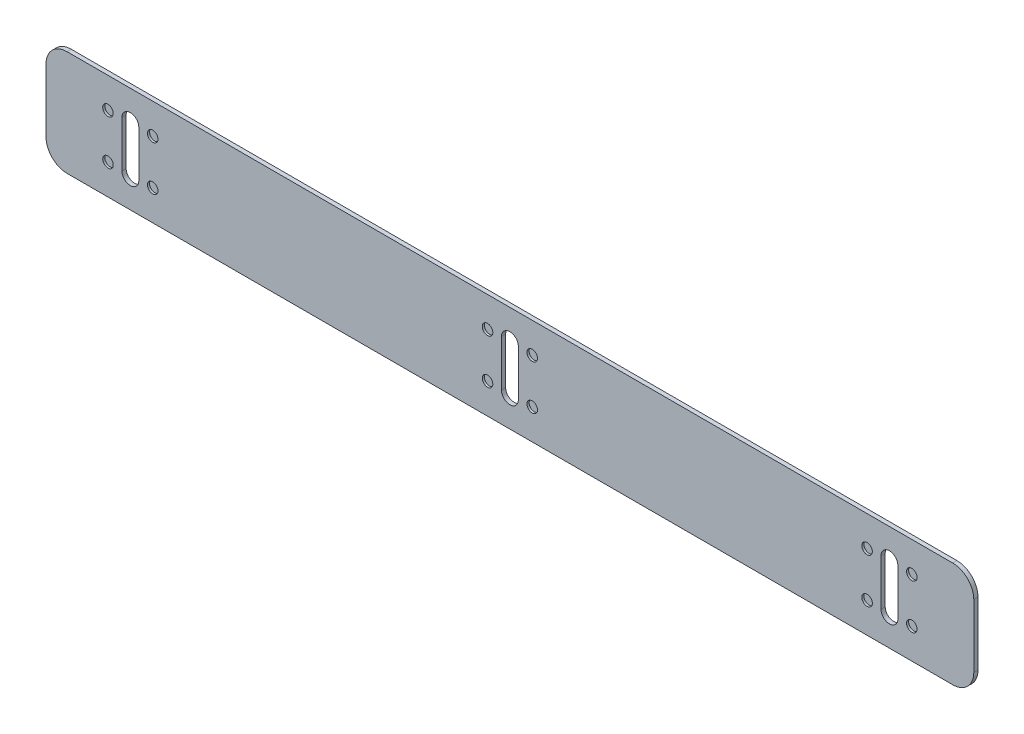
from build123d import *

# Parameters (mm, degrees)
BOSS_EXTRUDE1_DEPTH = 0.2
SKETCH2_R           = 0.25
CUT_EXTRUDE1_DEPTH  = 0.1


with BuildPart() as part:
    # Sketch1 → Boss-Extrude1 (new body)
    with BuildSketch(Plane.XY):
        with BuildLine():
            Line((-13.983305509, 11.944444444), (28.016694491, 11.944444444))
            ThreePointArc((28.016694491, 11.944444444), (28.723801272, 11.651551226), (29.016694491, 10.944444444))
            Line((29.016694491, 10.944444444), (29.016694491, 7.944444444))
            ThreePointArc((29.016694491, 7.944444444), (28.723801272, 7.237337663), (28.016694491, 6.944444444))
            Line((28.016694491, 6.944444444), (-13.983305509, 6.944444444))
            ThreePointArc((-13.983305509, 6.944444444), (-14.69041229, 7.237337663), (-14.983305509, 7.944444444))
            Line((-14.983305509, 7.944444444), (-14.983305509, 10.944444444))
            ThreePointArc((-14.983305509, 10.944444444), (-14.69041229, 11.651551226), (-13.983305509, 11.944444444))
        make_face()
        with BuildLine():
            Line((-10.583305509, 10.544444444), (-10.583305509, 8.344444444))
            ThreePointArc((-10.583305509, 8.344444444), (-10.983305509, 7.944444444), (-11.383305509, 8.344444444))
            Line((-11.383305509, 8.344444444), (-11.383305509, 10.544444444))
            ThreePointArc((-11.383305509, 10.544444444), (-10.983305509, 10.944444444), (-10.583305509, 10.544444444))
        make_face(mode=Mode.SUBTRACT)
        with BuildLine():
            Line((7.416694491, 10.544444444), (7.416694491, 8.344444444))
            ThreePointArc((7.416694491, 8.344444444), (7.016694491, 7.944444444), (6.616694491, 8.344444444))
            Line((6.616694491, 8.344444444), (6.616694491, 10.544444444))
            ThreePointArc((6.616694491, 10.544444444), (7.016694491, 10.944444444), (7.416694491, 10.544444444))
        make_face(mode=Mode.SUBTRACT)
        with BuildLine():
            Line((25.416694491, 10.544444444), (25.416694491, 8.344444444))
            ThreePointArc((25.416694491, 8.344444444), (25.016694491, 7.944444444), (24.616694491, 8.344444444))
            Line((24.616694491, 8.344444444), (24.616694491, 10.544444444))
            ThreePointArc((24.616694491, 10.544444444), (25.016694491, 10.944444444), (25.416694491, 10.544444444))
        make_face(mode=Mode.SUBTRACT)
    extrude(amount=BOSS_EXTRUDE1_DEPTH)

    # Sketch2 → Cut-Extrude1 (cut)
    with BuildSketch(Plane.XY.offset(0.2)):
        with Locations((-9.922645337, 10.505104616)):
            Circle(SKETCH2_R)
        with Locations((-9.922645337, 8.383784273)):
            Circle(SKETCH2_R)
        with Locations((-12.043965681, 8.383784273)):
            Circle(SKETCH2_R)
        with Locations((-12.043965681, 10.505104616)):
            Circle(SKETCH2_R)
        with Locations((8.077354663, 10.505104616)):
            Circle(SKETCH2_R)
        with Locations((5.956034319, 10.505104616)):
            Circle(SKETCH2_R)
        with Locations((5.956034319, 8.383784273)):
            Circle(SKETCH2_R)
        with Locations((8.077354663, 8.383784273)):
            Circle(SKETCH2_R)
        with Locations((26.077354663, 10.505104616)):
            Circle(SKETCH2_R)
        with Locations((23.956034319, 10.505104616)):
            Circle(SKETCH2_R)
        with Locations((23.956034319, 8.383784273)):
            Circle(SKETCH2_R)
        with Locations((26.077354663, 8.383784273)):
            Circle(SKETCH2_R)
    extrude(amount=-CUT_EXTRUDE1_DEPTH, mode=Mode.SUBTRACT)


solid = part.part
